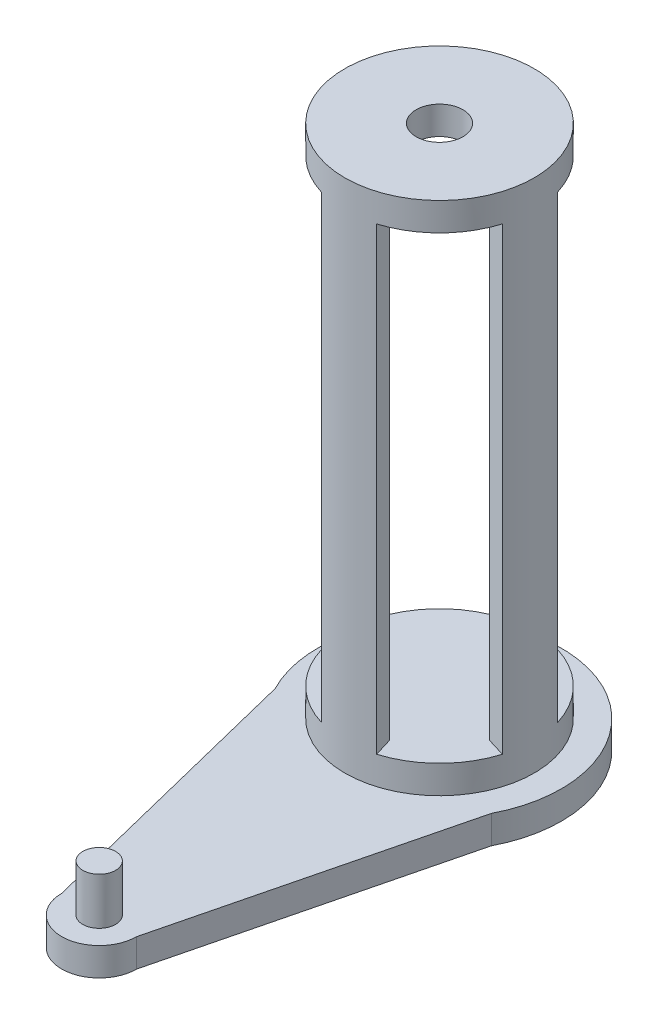
from build123d import *

# Parameters (mm, degrees)
SKETCH1_R           = 10.1
BOSS_EXTRUDE1_DEPTH = 3
BOSS_EXTRUDE2_DEPTH = 49
SKETCH3_R           = 10.1
SKETCH3_R_2         = 2.5
BOSS_EXTRUDE3_DEPTH = 3
BOSS_EXTRUDE6_DEPTH = 3
SKETCH5_R           = 1.75
BOSS_EXTRUDE7_DEPTH = 5


with BuildPart() as part:
    # Sketch1 → Boss-Extrude1 (new body)
    with BuildSketch(Plane(origin=(0, 0, 0), x_dir=(1, 0, 0), z_dir=(0, 1, 0))):
        with Locations(Location((0, 0, 0), (0, 0, 270))):
            Circle(SKETCH1_R)
    extrude(amount=BOSS_EXTRUDE1_DEPTH)

    # Sketch2 → Boss-Extrude2 (add)
    with BuildSketch(Plane(origin=(0, 3, 0), x_dir=(1, 0, 0), z_dir=(0, 1, 0))):
        with BuildLine():
            Line((-2.952954218, 9.658678035), (-2.338973638, 7.650438048))
            ThreePointArc((-2.338973638, 7.650438048), (0, 8), (2.338973638, 7.650438048))
            Line((2.338973638, 7.650438048), (2.952954218, 9.658678035))
            ThreePointArc((2.952954218, 9.658678035), (0, 10.1), (-2.952954218, 9.658678035))
        make_face()
        with BuildLine():
            Line((9.658678035, 2.952954218), (7.650438048, 2.338973638))
            ThreePointArc((7.650438048, 2.338973638), (8, 0), (7.650438048, -2.338973638))
            Line((7.650438048, -2.338973638), (9.658678035, -2.952954218))
            ThreePointArc((9.658678035, -2.952954218), (10.1, 0), (9.658678035, 2.952954218))
        make_face()
        with BuildLine():
            Line((2.952954218, -9.658678035), (2.338973638, -7.650438048))
            ThreePointArc((2.338973638, -7.650438048), (0, -8), (-2.338973638, -7.650438048))
            Line((-2.338973638, -7.650438048), (-2.952954218, -9.658678035))
            ThreePointArc((-2.952954218, -9.658678035), (0, -10.1), (2.952954218, -9.658678035))
        make_face()
        with BuildLine():
            Line((-9.658678035, -2.952954218), (-7.650438048, -2.338973638))
            ThreePointArc((-7.650438048, -2.338973638), (-8, 0), (-7.650438048, 2.338973638))
            Line((-7.650438048, 2.338973638), (-9.658678035, 2.952954218))
            ThreePointArc((-9.658678035, 2.952954218), (-10.1, 0), (-9.658678035, -2.952954218))
        make_face()
    extrude(amount=BOSS_EXTRUDE2_DEPTH)

    # Sketch3 → Boss-Extrude3 (add)
    with BuildSketch(Plane(origin=(0, 52, 0), x_dir=(1, 0, 0), z_dir=(0, 1, 0))):
        with Locations(Location((0, 0, 0), (0, 0, 270))):
            Circle(SKETCH3_R)
        with Locations(Location((0, 0, 0), (0, 0, 270))):
            Circle(SKETCH3_R_2, mode=Mode.SUBTRACT)
    extrude(amount=BOSS_EXTRUDE3_DEPTH)

    # Sketch4 → Boss-Extrude6 (add)
    with BuildSketch(Plane.XZ):
        with BuildLine():
            Line((-11.532649592, 5.999832781), (-4, 36.31))
            ThreePointArc((-4, 36.31), (0, 40.31), (4, 36.31))
            Line((4, 36.31), (11.532649592, 5.999832781))
            ThreePointArc((11.532649592, 5.999832781), (0, -13), (-11.532649592, 5.999832781))
        make_face()
    extrude(amount=BOSS_EXTRUDE6_DEPTH)

    # Sketch5 → Boss-Extrude7 (add)
    with BuildSketch(Plane(origin=(0, 0, 0), x_dir=(1, 0, 0), z_dir=(0, 1, 0))):
        with Locations(Location((0, -36.31, 0), (0, 0, 90))):
            Circle(SKETCH5_R)
    extrude(amount=BOSS_EXTRUDE7_DEPTH)


solid = part.part
